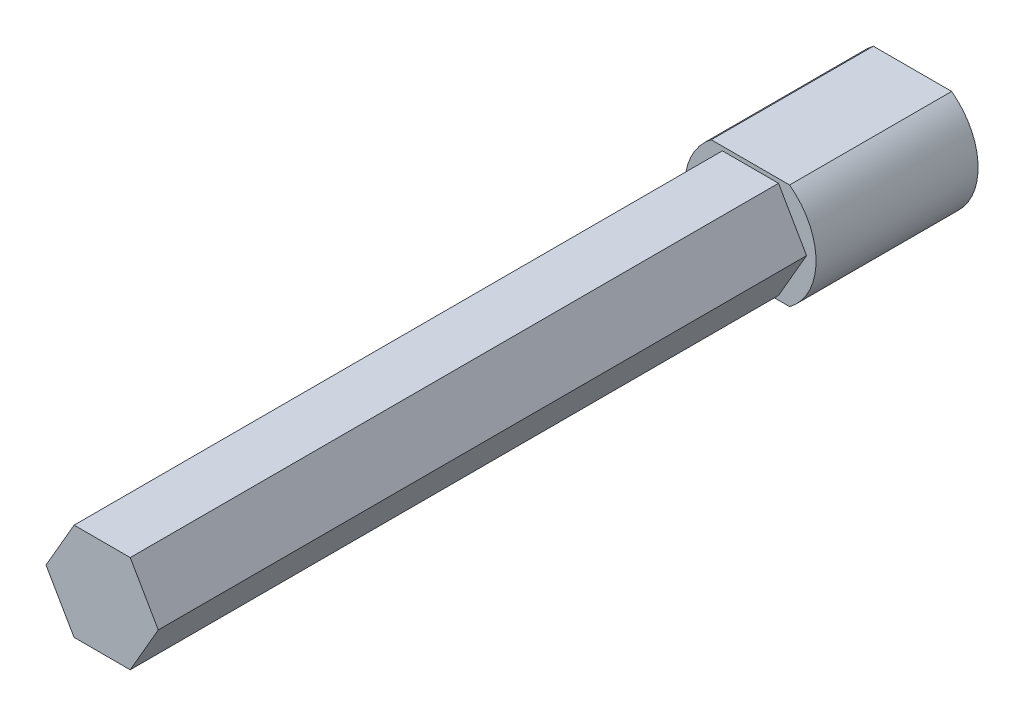
from build123d import *

# Parameters (mm, degrees)
BOSS_EXTRUDE2_DEPTH = 10
BOSS_EXTRUDE3_DEPTH = 40
CUT_EXTRUDE1_DEPTH  = 5


with BuildPart() as part:
    # Sketch1 → Boss-Extrude2 (new body)
    with BuildSketch(Plane.XY):
        with BuildLine():
            Line((-2.416609195, 3.25), (2.416609195, 3.25))
            ThreePointArc((2.416609195, 3.25), (4.05, 0), (2.416609195, -3.25))
            Line((2.416609195, -3.25), (-2.416609195, -3.25))
            ThreePointArc((-2.416609195, -3.25), (-4.05, 0), (-2.416609195, 3.25))
        make_face()
    extrude(amount=BOSS_EXTRUDE2_DEPTH)

    # Sketch4 → Boss-Extrude3 (add)
    with BuildSketch(Plane.XY.offset(10)):
        Polygon((1.730250139, -3.001038896), (3.464100991, -0.002078873), (1.733850853, 2.998960023), (-1.730250139, 3.001038896), (-3.464100991, 0.002078873), (-1.733850853, -2.998960023), align=None)
    extrude(amount=BOSS_EXTRUDE3_DEPTH)

    # Sketch3 → Cut-Extrude1 (cut)
    with BuildSketch(Plane(origin=(0, 0, 0), x_dir=(-1, 0, 0), z_dir=(0, 0, -1))):
        with BuildLine():
            Line((2.154065923, 2.5), (-2.154065923, 2.5))
            ThreePointArc((-2.154065923, 2.5), (-3.3, 0), (-2.154065923, -2.5))
            Line((-2.154065923, -2.5), (2.154065923, -2.5))
            ThreePointArc((2.154065923, -2.5), (3.3, 0), (2.154065923, 2.5))
        make_face()
    extrude(amount=-CUT_EXTRUDE1_DEPTH, mode=Mode.SUBTRACT)


solid = part.part
